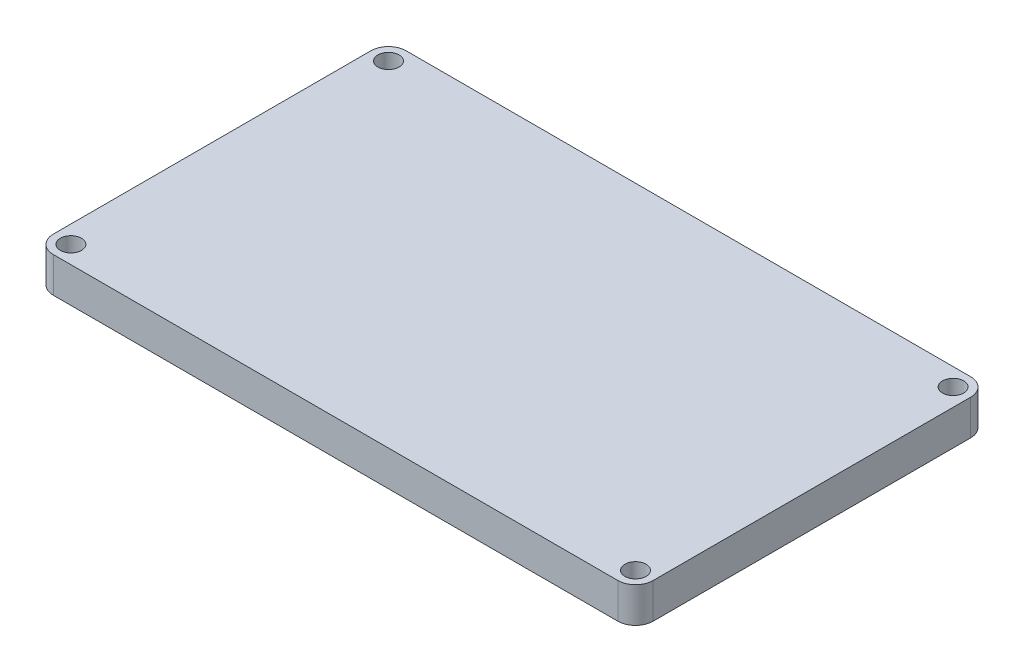
from build123d import *

# Parameters (mm, degrees)
SKETCH1_R           = 3
BOSS_EXTRUDE2_DEPTH = 10
FILLET1_R           = 5
FILLET2_R           = 5


with BuildPart() as part:
    # Sketch1 → Boss-Extrude2 (new body)
    # profile 1 of 2: a face of its own
    with BuildSketch(Plane(origin=(0, 0, 0), x_dir=(1, 0, 0), z_dir=(0, 1, 0))):
        with BuildLine():
            Line((99.310351883, 40.78525027), (-70.689648117, 40.78525027))
            Line((-70.689648117, 40.78525027), (-70.689648117, -54.21474973))
            Line((-70.689648117, -54.21474973), (-68.689648117, -54.21474973))
            ThreePointArc((-68.689648117, -54.21474973), (-65.689648117, -51.21474973), (-62.689648117, -54.21474973))
            ThreePointArc((-62.689648117, -54.21474973), (-63.568327773, -56.336070073), (-65.689648117, -57.21474973))
            Line((-65.689648117, -57.21474973), (-65.689648117, -59.21474973))
            Line((-65.689648117, -59.21474973), (99.310351883, -59.21474973))
            Line((99.310351883, -59.21474973), (99.310351883, 40.78525027))
        make_face()
        with Locations(Location((94.310351883, -54.21474973, 0), (0, 0, 270))):
            Circle(SKETCH1_R, mode=Mode.SUBTRACT)
        with Locations(Location((-65.689648117, 35.78525027, 0), (0, 0, 270))):
            Circle(SKETCH1_R, mode=Mode.SUBTRACT)
        with Locations(Location((94.310351883, 35.78525027, 0), (0, 0, 270))):
            Circle(SKETCH1_R, mode=Mode.SUBTRACT)
    # profile 2 of 2: a face of its own
    with BuildSketch(Plane(origin=(0, 0, 0), x_dir=(1, 0, 0), z_dir=(0, 1, 0))):
        with BuildLine():
            Line((-68.689648117, -54.21474973), (-70.689648117, -54.21474973))
            Line((-70.689648117, -54.21474973), (-70.689648117, -59.21474973))
            Line((-70.689648117, -59.21474973), (-65.689648117, -59.21474973))
            Line((-65.689648117, -59.21474973), (-65.689648117, -57.21474973))
            ThreePointArc((-65.689648117, -57.21474973), (-67.81096846, -56.336070073), (-68.689648117, -54.21474973))
        make_face()
    extrude(amount=BOSS_EXTRUDE2_DEPTH)

    # Fillet1
    fillet1_edges = [part.edges().sort_by_distance(p)[0] for p in [
        (-70.689648117, 5, 59.21474973),
    ]]
    fillet(fillet1_edges, radius=FILLET1_R)

    # Fillet2
    fillet2_edges = [part.edges().sort_by_distance(p)[0] for p in [
        (-70.689648117, 5, -40.78525027),
        (99.310351883, 5, -40.78525027),
        (99.310351883, 5, 59.21474973),
    ]]
    fillet(fillet2_edges, radius=FILLET2_R)


solid = part.part
